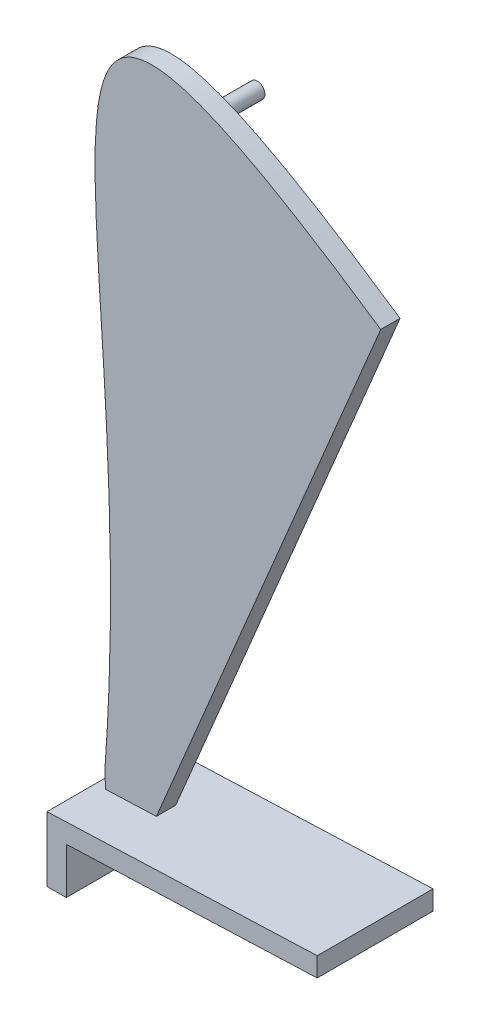
from build123d import *

# Parameters (mm, degrees)
BOSS_EXTRUDE1_DEPTH = 15
BOSS_EXTRUDE2_DEPTH = 2.5
SKETCH3_R           = 2
BOSS_EXTRUDE3_DEPTH = 15


with BuildPart() as part:
    # Sketch1 → Boss-Extrude1 (new, symmetric)
    with BuildSketch(Plane.XY):
        Polygon((-66, 10.962277833), (-1, 13.462277833), (-1, 18.465974691), (-71, 15.773666999), (-71, -1), (-66, -1), align=None)
    extrude(amount=BOSS_EXTRUDE1_DEPTH, both=True)

    # Sketch2 → Boss-Extrude2 (add, symmetric)
    with BuildSketch(Plane.XY):
        with BuildLine():
            Line((-68.329320747, 15.876385432), (-68.49608066, 20.212143147))
            add(Edge.make_bspline(
                [(-68.49608066, 20.212143147), (-58.446239367, 154.187541724), (-107.856515034, 229.820456607), (2.961147934, 154.665009331)],
                knots=[0, 0, 0, 0, 1, 1, 1, 1], degree=3))
            Line((2.961147934, 154.665009331), (-55.159919487, 16.382900865))
            Line((-55.159919487, 16.382900865), (-68.329320747, 15.876385432))
        make_face()
    extrude(amount=BOSS_EXTRUDE2_DEPTH, both=True)

    # Sketch3 → Boss-Extrude3 (add)
    with BuildSketch(Plane(origin=(0, 0, -2.5), x_dir=(-1, 0, 0), z_dir=(0, 0, -1))):
        with Locations((49.038852066, 172.382900865)):
            Circle(SKETCH3_R)
    extrude(amount=BOSS_EXTRUDE3_DEPTH)


solid = part.part
